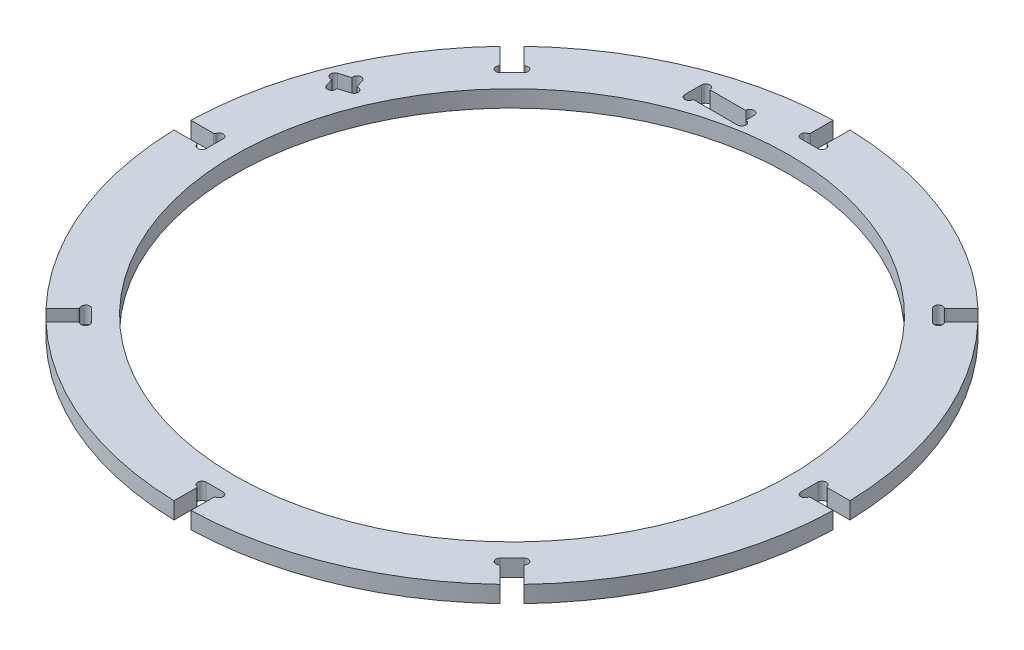
from build123d import *

# Parameters (mm, degrees)
SKETCH1_R                = 250
SKETCH1_R_2              = 210.5
BOSS_EXTRUDE1_DEPTH      = 12.7
CUT_EXTRUDE1_DEPTH       = 354.781415566
FILLET1_R                = 1
CIRPATTERN1_COUNT        = 8
FILLET1_OF_CIRPATTERN1_R = 1
SKETCH6_W                = 40
SKETCH6_H                = 12.7
CUT_EXTRUDE4_DEPTH       = 354.665618911
SKETCH7_R                = 3.2
CUT_EXTRUDE5_DEPTH       = 354.665618911


with BuildPart() as part:
    # Sketch1 → Boss-Extrude1 (new body)
    with BuildSketch(Plane(origin=(0, 0, 0), x_dir=(1, 0, 0), z_dir=(0, 1, 0))):
        with Locations(Location((0, 0, 0), (0, 0, 270))):
            Circle(SKETCH1_R)
        with Locations(Location((0, 0, 0), (0, 0, 270))):
            Circle(SKETCH1_R_2, mode=Mode.SUBTRACT)
    extrude(amount=BOSS_EXTRUDE1_DEPTH)

    # Sketch2 → Cut-Extrude1 (cut, through all)
    with BuildSketch(Plane(origin=(0, 12.7, 0), x_dir=(1, 0, 0), z_dir=(0, 1, 0))):
        with BuildLine():
            Line((6.4, 225.5), (-6.4, 225.5))
            ThreePointArc((-6.4, 225.5), (-9.6, 228.7), (-6.4, 231.9))
            Line((-6.4, 231.9), (-6.4, 250))
            Line((-6.4, 250), (6.4, 250))
            Line((6.4, 250), (6.4, 231.9))
            ThreePointArc((6.4, 231.9), (9.6, 228.7), (6.4, 225.5))
        make_face()
    cut_extrude1 = extrude(amount=-CUT_EXTRUDE1_DEPTH, mode=Mode.SUBTRACT)

    # Fillet1
    fillet1_edges = [part.edges().sort_by_distance(p)[0] for p in [
        (-6.4, 6.35, -231.9),
        (6.4, 6.35, -231.9),
    ]]
    fillet(fillet1_edges, radius=FILLET1_R)

    # CirPattern1: Cut-Extrude1 ×8 about axis
    cirpattern1_axis = Axis((0, 0, 0), (0, 1, 0))
    for i in range(1, CIRPATTERN1_COUNT):
        add(cut_extrude1.rotate(cirpattern1_axis, i * 360 / CIRPATTERN1_COUNT), mode=Mode.SUBTRACT)

    # Fillet1 of CirPattern1
    fillet1_of_cirpattern1_edges = [part.edges().sort_by_distance(p)[0] for p in [
        (-168.503545957, 6.35, -159.452579158),
        (-159.452579158, 6.35, -168.503545957),
        (-231.9, 6.35, 6.4),
        (-231.9, 6.35, -6.4),
        (-159.452579158, 6.35, 168.503545957),
        (-168.503545957, 6.35, 159.452579158),
        (6.4, 6.35, 231.9),
        (-6.4, 6.35, 231.9),
        (168.503545957, 6.35, 159.452579158),
        (159.452579158, 6.35, 168.503545957),
        (231.9, 6.35, -6.4),
        (231.9, 6.35, 6.4),
        (159.452579158, 6.35, -168.503545957),
        (168.503545957, 6.35, -159.452579158),
    ]]
    fillet(fillet1_of_cirpattern1_edges, radius=FILLET1_OF_CIRPATTERN1_R)

    # Sketch6 → Cut-Extrude4 (cut, through all)
    with BuildSketch(Plane(origin=(0, 12.7, 0), x_dir=(1, 0, 0), z_dir=(0, 1, 0))):
        with Locations((-59.506660352, 216.85)):
            Rectangle(SKETCH6_W, SKETCH6_H)
        Polygon((-225.095552296, 92.887646728), (-221.442085646, 80.724498227), (-207.076162221, 85.039616318), (-210.72962887, 97.202764818), align=None)
    extrude(amount=-CUT_EXTRUDE4_DEPTH, mode=Mode.SUBTRACT)

    # Sketch7 → Cut-Extrude5 (cut, through all)
    with BuildSketch(Plane(origin=(0, 12.7, 0), x_dir=(1, 0, 0), z_dir=(0, 1, 0))):
        with Locations((-224.17499377, 89.822916397)):
            Circle(SKETCH7_R)
        with Locations((-218.377355315, 81.645056753)):
            Circle(SKETCH7_R)
        with Locations((-207.996720747, 88.104346648)):
            Circle(SKETCH7_R)
        with Locations((-213.794359201, 96.282206292)):
            Circle(SKETCH7_R)
        with Locations((-76.306660352, 223.2)):
            Circle(SKETCH7_R)
        with Locations((-42.706660352, 223.2)):
            Circle(SKETCH7_R)
        with Locations((-39.506660352, 213.7)):
            Circle(SKETCH7_R)
        with Locations((-76.306660352, 210.5)):
            Circle(SKETCH7_R)
    extrude(amount=-CUT_EXTRUDE5_DEPTH, mode=Mode.SUBTRACT)


solid = part.part
